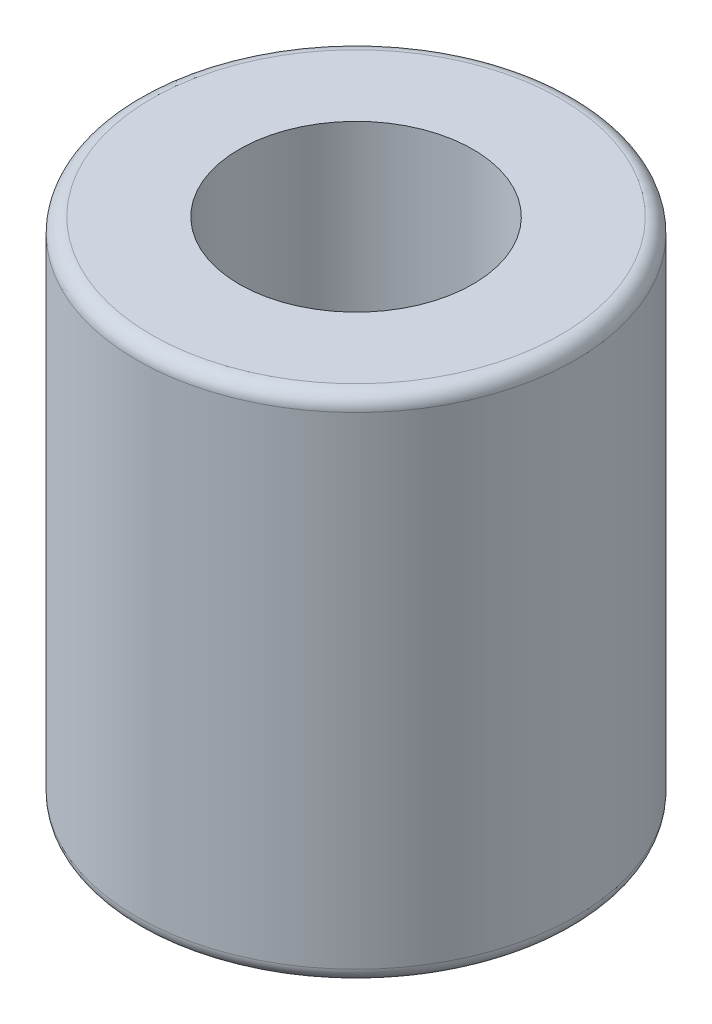
from build123d import *

# Parameters (mm, degrees)
SKETCH1_R           = 3
BOSS_EXTRUDE1_DEPTH = 7
SKETCH2_R           = 1.6
CUT_EXTRUDE1_DEPTH  = 9.185352772
FILLET1_R           = 0.2


with BuildPart() as part:
    # Sketch1 → Boss-Extrude1 (new body)
    with BuildSketch(Plane(origin=(0, 0, 0), x_dir=(1, 0, 0), z_dir=(0, 1, 0))):
        with Locations(Location((0, 0, 0), (0, 0, 270))):
            Circle(SKETCH1_R)
    extrude(amount=BOSS_EXTRUDE1_DEPTH)

    # Sketch2 → Cut-Extrude1 (cut, through all)
    with BuildSketch(Plane(origin=(0, 7, 0), x_dir=(1, 0, 0), z_dir=(0, 1, 0))):
        with Locations(Location((0, 0, 0), (0, 0, 270))):
            Circle(SKETCH2_R)
    extrude(amount=-CUT_EXTRUDE1_DEPTH, mode=Mode.SUBTRACT)

    # Fillet1
    fillet1_edges = [part.edges().sort_by_distance(p)[0] for p in [
        (0, 0, -3),
        (0, 7, -3),
    ]]
    fillet(fillet1_edges, radius=FILLET1_R)


solid = part.part
